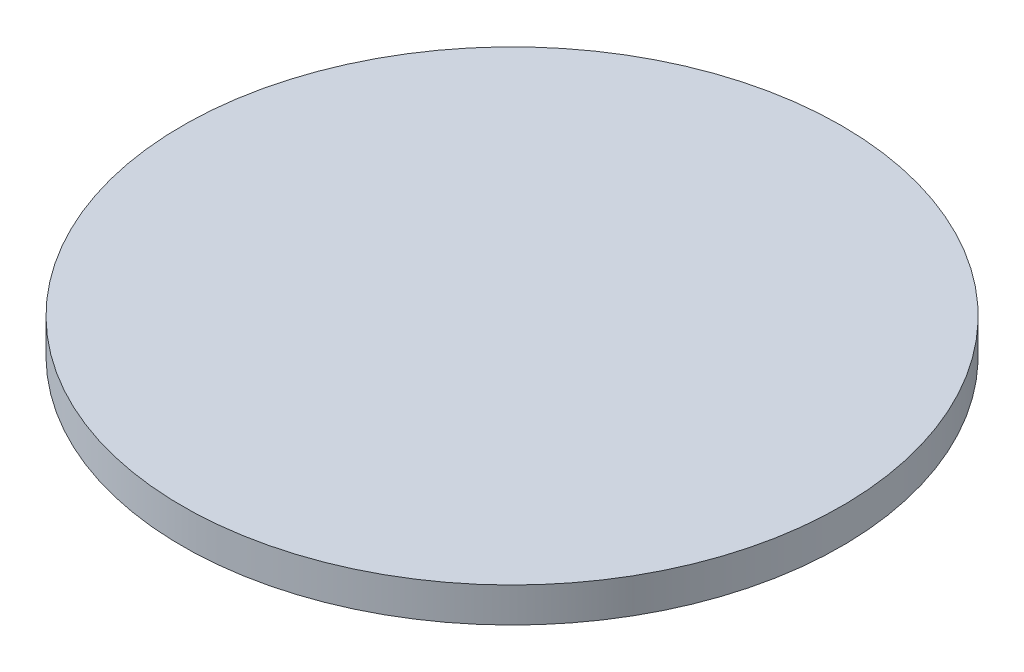
from build123d import *


with BuildPart() as part:
    # Sketch1 → Revolve1 (revolve)
    with BuildSketch(Plane.XY, mode=Mode.PRIVATE) as revolve1_sk:
        Polygon((0, 0), (0, 6), (-9.5, 6), (-9.5, 5), (-2.1, 5), (-2.1, 3), (-3, 3), (-2.1, 0), align=None)
    revolve(revolve1_sk.sketch.rotate(Axis((0, 0, 0), (0, 1, 0)), 270), axis=Axis((0, 0, 0), (0, 1, 0)))


solid = part.part
